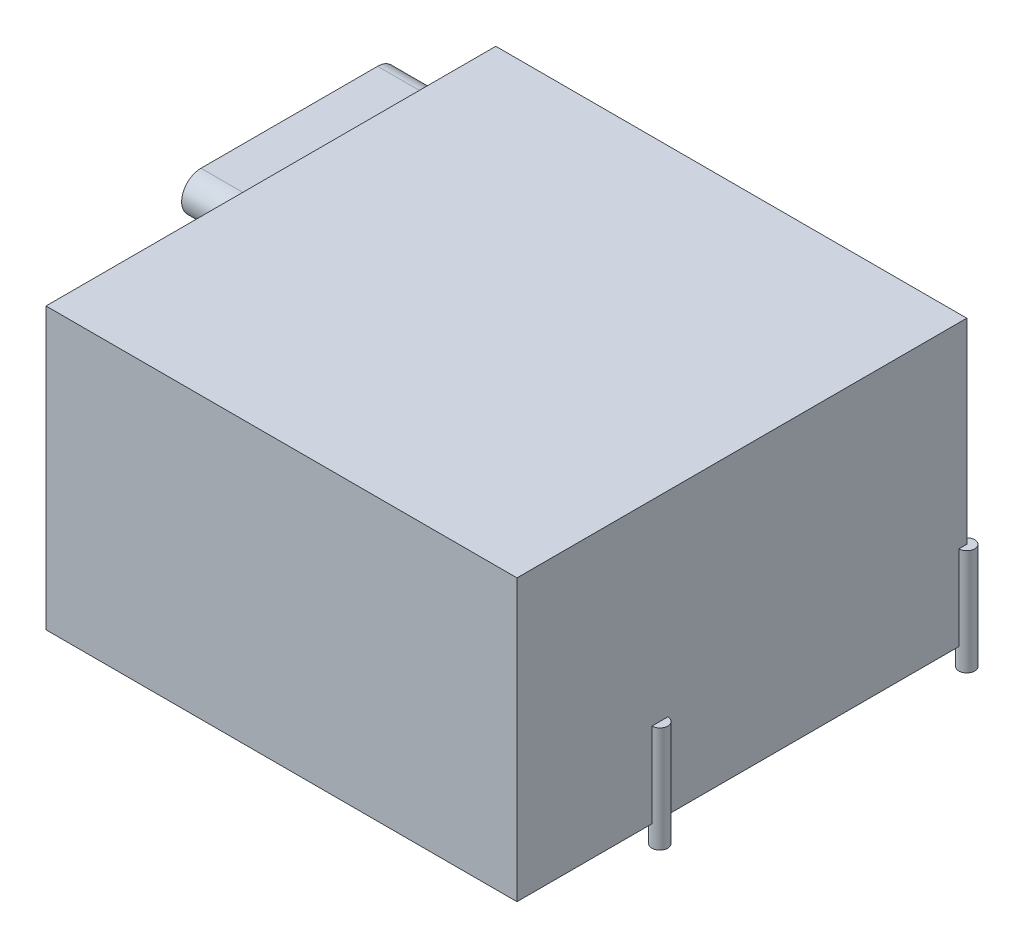
from build123d import *

# Parameters (mm, degrees)
SKETCH2_R                = 1.5
BOSS_EXTRUDE1_DEPTH      = 20
BOSS_EXTRUDE1_2_DEPTH    = 20
BOSS_EXTRUDE1_3_DEPTH    = 20
BOSS_EXTRUDE1_4_DEPTH    = 20
BOSS_EXTRUDE2_DEPTH      = 37
BOSS_EXTRUDE2_DEPTH_BACK = 16
SKETCH3_W                = 89
SKETCH3_H                = 85
BOSS_EXTRUDE5_DEPTH      = 14
SKETCH8_W                = 8
SKETCH8_H                = 8
BOSS_EXTRUDE6_DEPTH      = 5


with BuildPart() as part:
    # Sketch2 → Boss-Extrude1 (new body)
    with BuildSketch(Plane(origin=(0, 0, 0), x_dir=(1, 0, 0), z_dir=(0, 1, 0))):
        with Locations(Location((-44.5, 29, 0), (0, 0, 270))):
            Circle(SKETCH2_R)
    extrude(amount=BOSS_EXTRUDE1_DEPTH)



with BuildPart() as body_2:
    # Sketch2 → Boss-Extrude1 2 (new body)
    with BuildSketch(Plane(origin=(0, 0, 0), x_dir=(1, 0, 0), z_dir=(0, 1, 0))):
        with Locations(Location((44.5, 29, 0), (0, 0, 270))):
            Circle(SKETCH2_R)
    extrude(amount=BOSS_EXTRUDE1_2_DEPTH)


with BuildPart() as body_3:
    # Sketch2 → Boss-Extrude1 3 (new body)
    with BuildSketch(Plane(origin=(0, 0, 0), x_dir=(1, 0, 0), z_dir=(0, 1, 0))):
        with Locations(Location((-44.5, -29, 0), (0, 0, 270))):
            Circle(SKETCH2_R)
    extrude(amount=BOSS_EXTRUDE1_3_DEPTH)


with BuildPart() as body_4:
    # Sketch2 → Boss-Extrude1 4 (new body)
    with BuildSketch(Plane(origin=(0, 0, 0), x_dir=(1, 0, 0), z_dir=(0, 1, 0))):
        with Locations(Location((44.5, -29, 0), (0, 0, 270))):
            Circle(SKETCH2_R)
    extrude(amount=BOSS_EXTRUDE1_4_DEPTH)


with BuildPart() as part_1:
    add(part.part)

    add(body_2.part)  # Boss-Extrude2 merges body 2

    add(body_3.part)  # Boss-Extrude2 merges body 3

    add(body_4.part)  # Boss-Extrude2 merges body 4
    # Sketch3 → Boss-Extrude2 (add, two sides: drawn at the far end of the back side and taken through both)
    with BuildSketch(Plane(origin=(0, 20, 0), x_dir=(1, 0, 0), z_dir=(0, 1, 0)).offset(-BOSS_EXTRUDE2_DEPTH_BACK)):
        with Locations((0, -13.5)):
            Rectangle(SKETCH3_W, SKETCH3_H)
    extrude(amount=BOSS_EXTRUDE2_DEPTH + BOSS_EXTRUDE2_DEPTH_BACK)

    # Sketch7 → Boss-Extrude5 (add)
    with BuildSketch(Plane.ZY.offset(44.5)):
        with BuildLine():
            Line((-20.661260067, 50.895180513), (12.711227635, 50.895180513))
            ThreePointArc((12.711227635, 50.895180513), (16.370214945, 47.236193203), (12.711227635, 43.577205894))
            Line((12.711227635, 43.577205894), (-20.661260067, 43.577205894))
            ThreePointArc((-20.661260067, 43.577205894), (-24.320247376, 47.236193203), (-20.661260067, 50.895180513))
        make_face()
    extrude(amount=BOSS_EXTRUDE5_DEPTH)

    # Sketch8 → Boss-Extrude6 (add)
    with BuildSketch(Plane(origin=(0, 0, -29), x_dir=(-1, 0, 0), z_dir=(0, 0, -1))):
        with Locations((-30.8, 27.15)):
            Rectangle(SKETCH8_W, SKETCH8_H)
    extrude(amount=BOSS_EXTRUDE6_DEPTH)


solid = part_1.part
